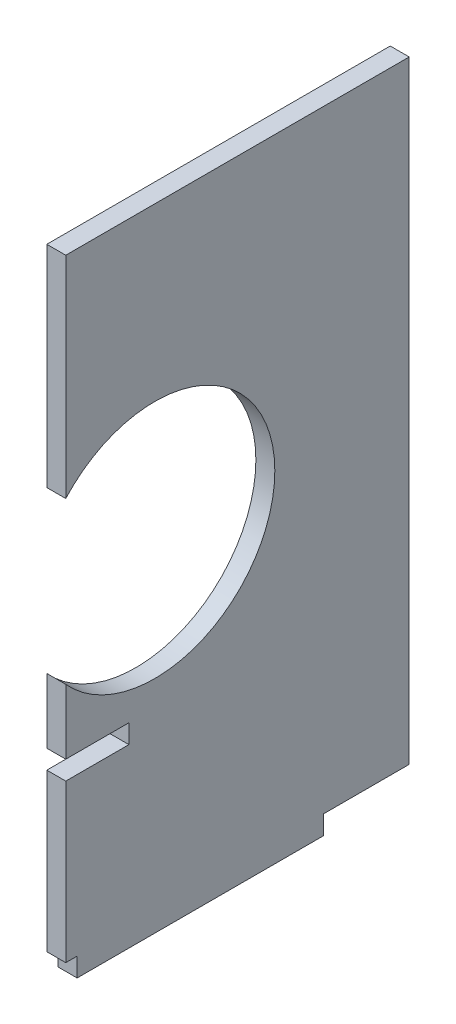
from build123d import *

# Parameters (mm, degrees)
BOSS_EXTRU_1_DEPTH = 3


with BuildPart() as part:
    # Esquisse1 → Boss.-Extru.1 (new body)
    with BuildSketch(Plane(origin=(3, 0, 0), x_dir=(0, 0, -1), z_dir=(1, 0, 0))):
        with BuildLine():
            Line((-5.105655505, -9.426547116), (-59.475655505, -9.426547116))
            Line((-59.475655505, -9.426547116), (-59.475655505, -42.788807913))
            ThreePointArc((-59.475655505, -42.788807913), (-26.377783326, -55.526547116), (-59.475655505, -68.264286319))
            Line((-59.475655505, -68.264286319), (-59.475655505, -78.526547116))
            Line((-59.475655505, -78.526547116), (-49.475655505, -78.526547116))
            Line((-49.475655505, -78.526547116), (-49.475655505, -81.526547116))
            Line((-49.475655505, -81.526547116), (-59.475655505, -81.526547116))
            Line((-59.475655505, -81.526547116), (-59.475655505, -106.426547116))
            Line((-59.475655505, -106.426547116), (-57.675655505, -106.426547116))
            Line((-57.675655505, -106.426547116), (-57.675655505, -109.426547116))
            Line((-57.675655505, -109.426547116), (-18.675655505, -109.426547116))
            Line((-18.675655505, -109.426547116), (-18.675655505, -106.426547116))
            Line((-18.675655505, -106.426547116), (-5.105655505, -106.426547116))
            Line((-5.105655505, -106.426547116), (-5.105655505, -9.426547116))
        make_face()
    extrude(amount=-BOSS_EXTRU_1_DEPTH)


solid = part.part
